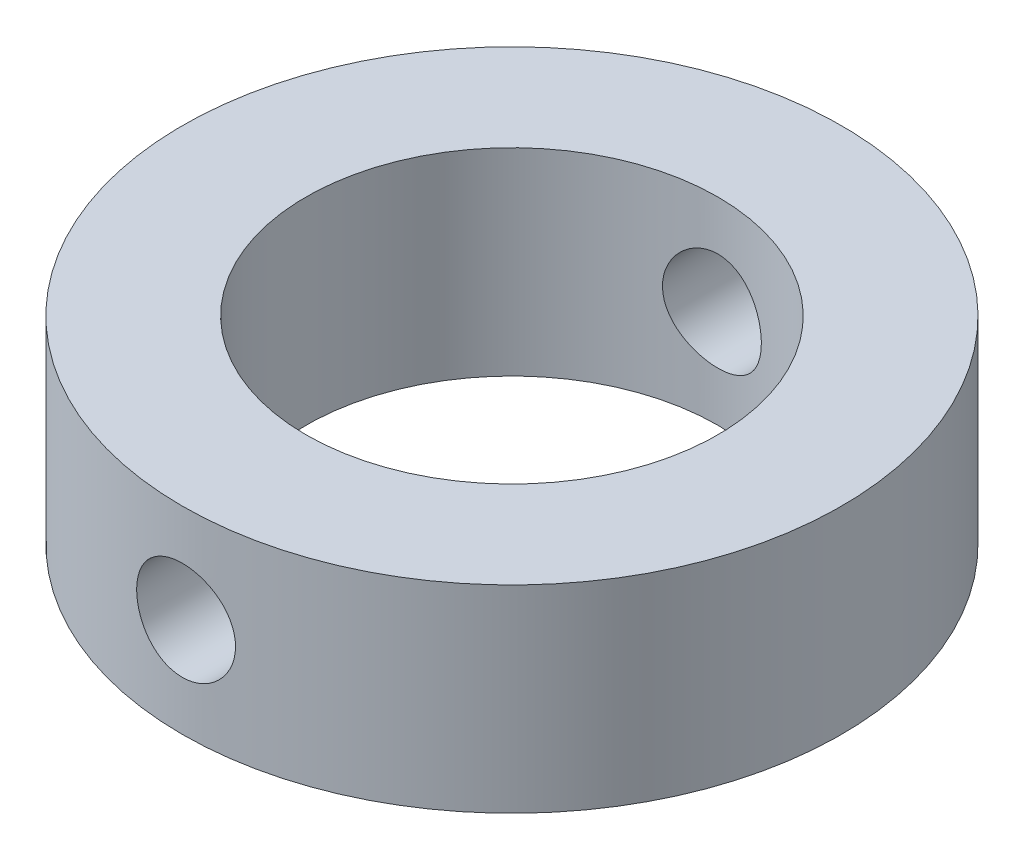
from build123d import *

# Parameters (mm, degrees)
SKETCH1_R           = 20
SKETCH1_R_2         = 12.5
BOSS_EXTRUDE1_DEPTH = 12
CUT_EXTRUDE1_DEPTH  = 62


with BuildPart() as part:
    # Sketch1 → Boss-Extrude1 (new body)
    with BuildSketch(Plane(origin=(0, 0, 0), x_dir=(1, 0, 0), z_dir=(0, 1, 0))):
        with Locations(Location((0, 0, 0), (0, 0, 270))):
            Circle(SKETCH1_R)
        with Locations(Location((0, 0, 0), (0, 0, 270))):
            Circle(SKETCH1_R_2, mode=Mode.SUBTRACT)
    extrude(amount=BOSS_EXTRUDE1_DEPTH)

    # Sketch3 → Cut-Extrude1 (cut)
    with BuildSketch(Plane.XY.offset(20)):
        with BuildLine():
            ThreePointArc((0, 9), (-3, 6), (0, 3))
            Line((0, 3), (0, 9))
        make_face()
        with BuildLine():
            Line((0, 9), (0, 3))
            ThreePointArc((0, 3), (2.121320344, 3.878679656), (3, 6))
            ThreePointArc((3, 6), (2.121320344, 8.121320344), (0, 9))
        make_face()
    extrude(amount=-CUT_EXTRUDE1_DEPTH, mode=Mode.SUBTRACT)


solid = part.part
